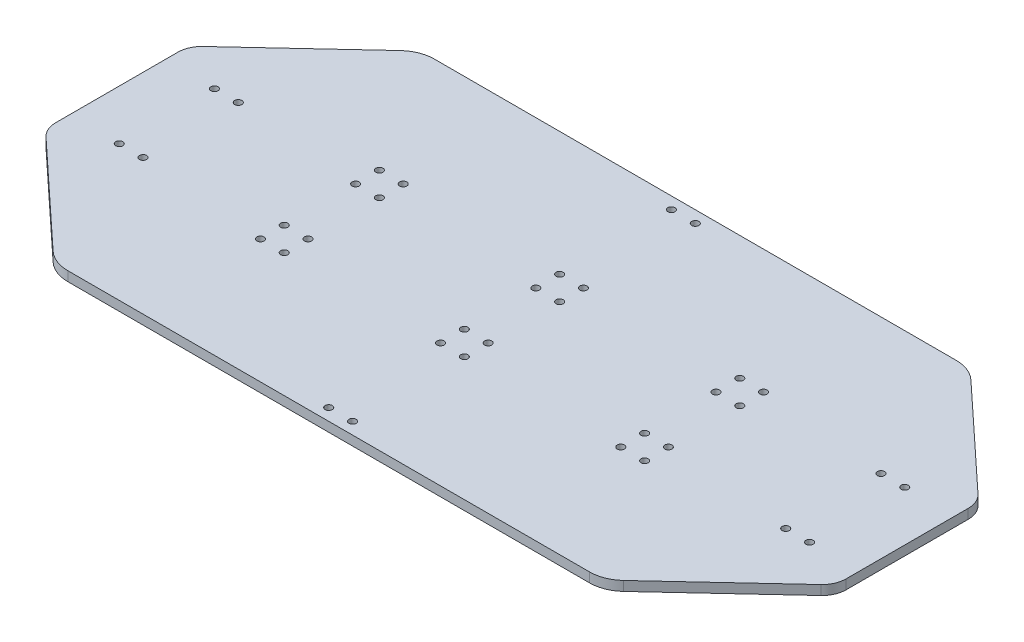
from build123d import *

# Parameters (mm, degrees)
EXTRUDE_1_DEPTH     = 4
SKETCH_2_R          = 1.5
CUT_EXTRUDE_1_DEPTH = 184.032783949


with BuildPart() as part:
    # 草图1 → 凸台-拉伸1 (new body)
    with BuildSketch(Plane(origin=(0, 0, 0), x_dir=(1, 0, 0), z_dir=(0, 1, 0))):
        with BuildLine():
            Line((-119.819061856, 72.980279065), (-162.812846416, 32.966261751))
            ThreePointArc((-162.812846416, 32.966261751), (-165.168654868, 29.638038623), (-166, 25.646075708))
            Line((-166, 25.646075708), (-166, -25.646075708))
            ThreePointArc((-166, -25.646075708), (-165.168654868, -29.638038623), (-162.812846416, -32.966261751))
            Line((-162.812846416, -32.966261751), (-119.819061856, -72.980279065))
            ThreePointArc((-119.819061856, -72.980279065), (-115.090503207, -75.958943119), (-109.599792231, -77))
            Line((-109.599792231, -77), (109.599792231, -77))
            ThreePointArc((109.599792231, -77), (115.090503207, -75.958943119), (119.819061856, -72.980279065))
            Line((119.819061856, -72.980279065), (162.812846416, -32.966261751))
            ThreePointArc((162.812846416, -32.966261751), (165.168654868, -29.638038623), (166, -25.646075708))
            Line((166, -25.646075708), (166, 25.646075708))
            ThreePointArc((166, 25.646075708), (165.168654868, 29.638038623), (162.812846416, 32.966261751))
            Line((162.812846416, 32.966261751), (119.819061856, 72.980279065))
            ThreePointArc((119.819061856, 72.980279065), (115.090503207, 75.958943119), (109.599792231, 77))
            Line((109.599792231, 77), (-109.599792231, 77))
            ThreePointArc((-109.599792231, 77), (-115.090503207, 75.958943119), (-119.819061856, 72.980279065))
        make_face()
    extrude(amount=EXTRUDE_1_DEPTH)

    # 草图2 → 切除-拉伸1 (cut, through all)
    with BuildSketch(Plane.XZ):
        with Locations(Location((5, 25, 0), (0, 0, 270))):
            Circle(SKETCH_2_R)
        with Locations(Location((-5, 25, 0), (0, 0, 270))):
            Circle(SKETCH_2_R)
        with Locations(Location((-5, 15, 0), (0, 0, 270))):
            Circle(SKETCH_2_R)
        with Locations(Location((5, 15, 0), (0, 0, 270))):
            Circle(SKETCH_2_R)
        with Locations(Location((-5, -15, 0), (0, 0, 270))):
            Circle(SKETCH_2_R)
        with Locations(Location((5, -15, 0), (0, 0, 270))):
            Circle(SKETCH_2_R)
        with Locations(Location((-5, -25, 0), (0, 0, 270))):
            Circle(SKETCH_2_R)
        with Locations(Location((5, -25, 0), (0, 0, 270))):
            Circle(SKETCH_2_R)
        with Locations(Location((-70.7, -15, 0), (0, 0, 270))):
            Circle(SKETCH_2_R)
        with Locations(Location((-70.7, -25, 0), (0, 0, 270))):
            Circle(SKETCH_2_R)
        with Locations(Location((-80.7, -25, 0), (0, 0, 270))):
            Circle(SKETCH_2_R)
        with Locations(Location((-80.7, -15, 0), (0, 0, 270))):
            Circle(SKETCH_2_R)
        with Locations(Location((-70.7, 25, 0), (0, 0, 270))):
            Circle(SKETCH_2_R)
        with Locations(Location((-80.7, 25, 0), (0, 0, 270))):
            Circle(SKETCH_2_R)
        with Locations(Location((-80.7, 15, 0), (0, 0, 270))):
            Circle(SKETCH_2_R)
        with Locations(Location((-70.7, 15, 0), (0, 0, 270))):
            Circle(SKETCH_2_R)
        with Locations(Location((70.7, 25, 0), (0, 0, 270))):
            Circle(SKETCH_2_R)
        with Locations(Location((70.7, 15, 0), (0, 0, 270))):
            Circle(SKETCH_2_R)
        with Locations(Location((80.7, 15, 0), (0, 0, 270))):
            Circle(SKETCH_2_R)
        with Locations(Location((80.7, 25, 0), (0, 0, 270))):
            Circle(SKETCH_2_R)
        with Locations(Location((70.7, -15, 0), (0, 0, 270))):
            Circle(SKETCH_2_R)
        with Locations(Location((80.7, -15, 0), (0, 0, 270))):
            Circle(SKETCH_2_R)
        with Locations(Location((70.7, -25, 0), (0, 0, 270))):
            Circle(SKETCH_2_R)
        with Locations(Location((80.7, -25, 0), (0, 0, 270))):
            Circle(SKETCH_2_R)
        with Locations(Location((5, -72, 0), (0, 0, 270))):
            Circle(SKETCH_2_R)
        with Locations(Location((-5, -72, 0), (0, 0, 270))):
            Circle(SKETCH_2_R)
        with Locations(Location((-5, 72, 0), (0, 0, 90))):
            Circle(SKETCH_2_R)
        with Locations(Location((5, 72, 0), (0, 0, 90))):
            Circle(SKETCH_2_R)
        with Locations(Location((-145, 20, 0), (0, 0, 270))):
            Circle(SKETCH_2_R)
        with Locations(Location((-135, 20, 0), (0, 0, 270))):
            Circle(SKETCH_2_R)
        with Locations(Location((-145, -20, 0), (0, 0, 270))):
            Circle(SKETCH_2_R)
        with Locations(Location((-135, -20, 0), (0, 0, 270))):
            Circle(SKETCH_2_R)
        with Locations(Location((145, 20, 0), (0, 0, 90))):
            Circle(SKETCH_2_R)
        with Locations(Location((135, -20, 0), (0, 0, 90))):
            Circle(SKETCH_2_R)
        with Locations(Location((135, 20, 0), (0, 0, 90))):
            Circle(SKETCH_2_R)
        with Locations(Location((145, -20, 0), (0, 0, 90))):
            Circle(SKETCH_2_R)
    extrude(amount=-CUT_EXTRUDE_1_DEPTH, mode=Mode.SUBTRACT)


solid = part.part
